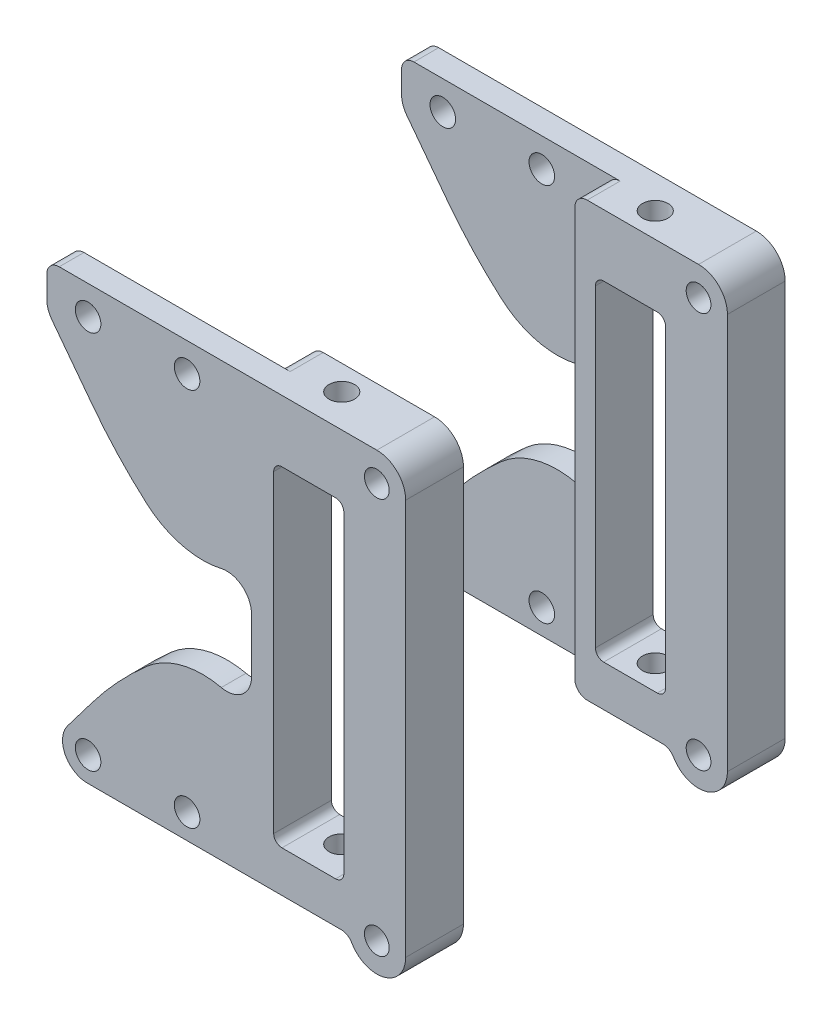
from build123d import *

# Parameters (mm, degrees)
SKETCH_3_R          = 1.5
SKETCH_3_R_2        = 1.55
EXTRUDE_1_DEPTH     = 3
SKETCH_4_R          = 1.5
EXTRUDE_2_DEPTH     = 4
SKETCH_5_W          = 8.5
SKETCH_5_H          = 40
CUT_EXTRUDE_1_DEPTH = 17
SKETCH_7_R          = 1.55
CUT_EXTRUDE_2_DEPTH = 57
FILLET_1_R          = 1
FILLET_2_R          = 1.5
CUT_EXTRUDE_3_DEPTH = 59.519227609
FILLET_3_R          = 3


with BuildPart() as part:
    # 草图3 → 凸台-拉伸1 (new body)
    with BuildSketch(Plane.XY):
        with BuildLine():
            Line((45, 22.5), (5, 22.5))
            Line((5, 22.5), (5, -30))
            Line((5, -30), (41.645898034, -30))
            ThreePointArc((41.645898034, -30), (45.505293538, -32.463333429), (48.5, -29))
            Line((48.5, -29), (48.5, 19))
            ThreePointArc((48.5, 19), (47.474873734, 21.474873734), (45, 22.5))
        make_face()
        with Locations((45, 19)):
            Circle(SKETCH_3_R, mode=Mode.SUBTRACT)
        with Locations((45, -29)):
            Circle(SKETCH_3_R, mode=Mode.SUBTRACT)
        with Locations((22, 19)):
            Circle(SKETCH_3_R_2, mode=Mode.SUBTRACT)
        with Locations((10, 19)):
            Circle(SKETCH_3_R_2, mode=Mode.SUBTRACT)
        with Locations((10, -27)):
            Circle(SKETCH_3_R_2, mode=Mode.SUBTRACT)
        with Locations((22, -27)):
            Circle(SKETCH_3_R_2, mode=Mode.SUBTRACT)
    extrude(amount=EXTRUDE_1_DEPTH)

    # 草图4 → 凸台-拉伸2 (add)
    with BuildSketch(Plane.XY.offset(3)):
        with BuildLine():
            Line((30, 22.5), (30, -30))
            Line((30, -30), (41.645898034, -30))
            ThreePointArc((41.645898034, -30), (45.505293538, -32.463333429), (48.5, -29))
            Line((48.5, -29), (48.5, 19))
            ThreePointArc((48.5, 19), (47.474873734, 21.474873734), (45, 22.5))
            Line((45, 22.5), (30, 22.5))
        make_face()
        with Locations((45, 19)):
            Circle(SKETCH_4_R, mode=Mode.SUBTRACT)
        with Locations((45, -29)):
            Circle(SKETCH_4_R, mode=Mode.SUBTRACT)
    extrude(amount=EXTRUDE_2_DEPTH)

    # 草图5 → 切除-拉伸1 (cut)
    with BuildSketch(Plane.XY.offset(7)):
        with Locations((36.75, -5)):
            Rectangle(SKETCH_5_W, SKETCH_5_H)
    extrude(amount=-CUT_EXTRUDE_1_DEPTH, mode=Mode.SUBTRACT)

    # 草图7 → 切除-拉伸2 (cut)
    with BuildSketch(Plane(origin=(0, 22.5, 0), x_dir=(1, 0, 0), z_dir=(0, 1, 0))):
        with Locations(Location((36.75, -4, 0), (0, 0, 180))):
            Circle(SKETCH_7_R)
    extrude(amount=-CUT_EXTRUDE_2_DEPTH, mode=Mode.SUBTRACT)

    # 圆角1
    fillet_1_edges = [part.edges().sort_by_distance(p)[0] for p in [
        (32.5, -25, 3.5),
        (32.5, 15, 3.5),
        (41, 15, 3.5),
        (41, -25, 3.5),
    ]]
    fillet(fillet_1_edges, radius=FILLET_1_R)

    # 圆角2
    fillet_2_edges = [part.edges().sort_by_distance(p)[0] for p in [
        (41.645898034, -30, 3.5),
        (5, -30, 1.5),
        (5, 22.5, 1.5),
        (30, 22.5, 5),
        (30, -30, 5),
    ]]
    fillet(fillet_2_edges, radius=FILLET_2_R)

    # 草图8 → 切除-拉伸3 (cut, through all)
    with BuildSketch(Plane.XY.offset(3)):
        with BuildLine():
            Line((29.809263128, -13.476437304), (29.809263128, 2.276247187))
            ThreePointArc((29.809263128, 2.276247187), (23.352075159, 0.405204035), (17.123253934, 2.93460418))
            ThreePointArc((17.123253934, 2.93460418), (13.629555634, 6.324061552), (10.496392348, 10.049331598))
            Line((10.496392348, 10.049331598), (5, 17.299809883))
            Line((5, 17.299809883), (2.692213842, 20.344089178))
            Line((2.692213842, 20.344089178), (2.692213842, -31.544279295))
            Line((2.692213842, -31.544279295), (5, -28.5))
            Line((5, -28.5), (10.496392348, -21.249521715))
            ThreePointArc((10.496392348, -21.249521715), (13.629555634, -17.524251669), (17.123253934, -14.134794297))
            ThreePointArc((17.123253934, -14.134794297), (23.352075159, -11.605394152), (29.809263128, -13.476437304))
        make_face()
    extrude(amount=-CUT_EXTRUDE_3_DEPTH, mode=Mode.SUBTRACT)

    # 圆角3
    fillet_3_edges = [part.edges().sort_by_distance(p)[0] for p in [
        (5, -28.5, 1.5),
        (29.809263128, -13.476437304, 1.5),
        (5, 17.299809883, 1.5),
        (29.809263128, 2.276247187, 1.5),
    ]]
    fillet(fillet_3_edges, radius=FILLET_3_R)


with BuildPart() as body_2:
    # 镜向1: mirrored copy
    add(part.part.mirror(Plane.XY.offset(23)))


solid = Compound([part.part, body_2.part])
